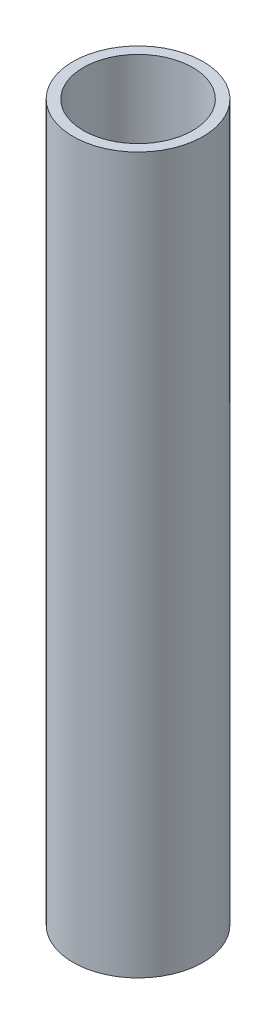
from build123d import *

# Parameters (mm, degrees)
SKETCH_1_R          = 9.45
EXTRUDE_1_DEPTH     = 104
SKETCH_2_R          = 7.95
CUT_EXTRUDE_1_DEPTH = 103


with BuildPart() as part:
    # ｽｹｯﾁ1 → ﾎﾞｽ - 押し出し1 (new body)
    with BuildSketch(Plane(origin=(0, 0, 0), x_dir=(1, 0, 0), z_dir=(0, 1, 0))):
        with Locations(Location((0, 0, 0), (0, 0, 90))):
            Circle(SKETCH_1_R)
    extrude(amount=EXTRUDE_1_DEPTH)

    # ｽｹｯﾁ2 → ｶｯﾄ - 押し出し1 (cut)
    with BuildSketch(Plane(origin=(0, 104, 0), x_dir=(1, 0, 0), z_dir=(0, 1, 0))):
        with Locations(Location((0, 0, 0), (0, 0, 270))):
            Circle(SKETCH_2_R)
    extrude(amount=-CUT_EXTRUDE_1_DEPTH, mode=Mode.SUBTRACT)


solid = part.part
